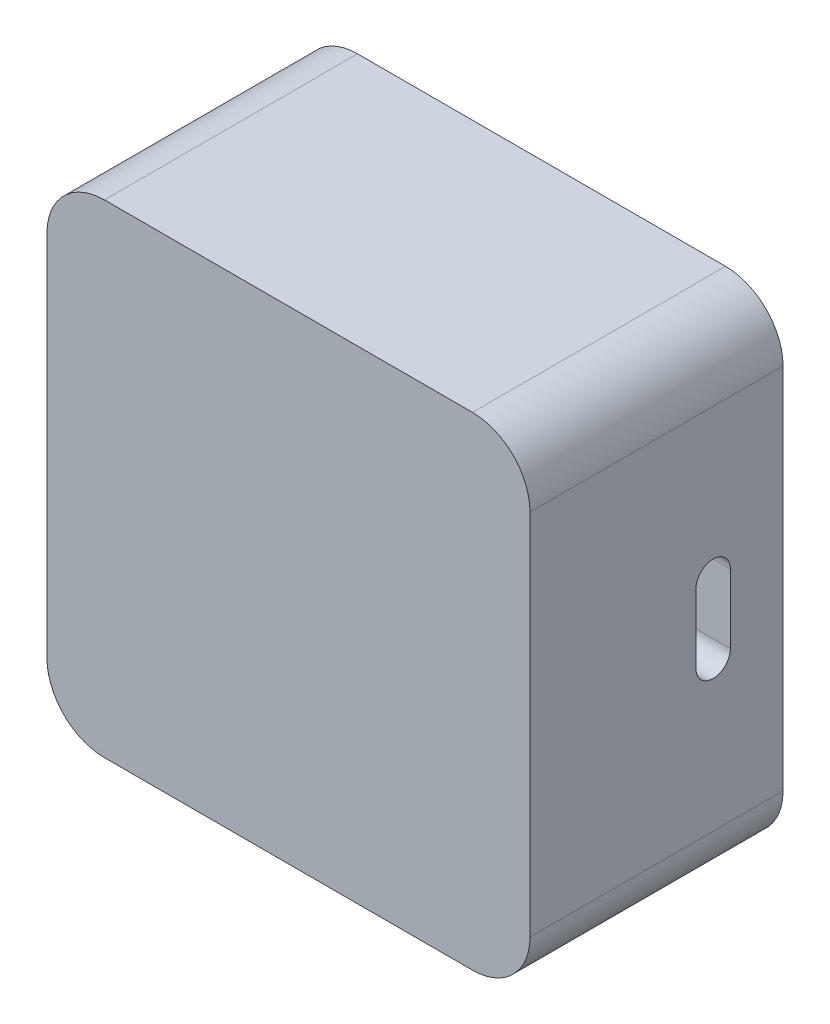
from build123d import *

# Parameters (mm, degrees)
SKETCH_1_W          = 42
SKETCH_1_H          = 42
EXTRUDE_1_DEPTH     = 22
SKETCH_2_R          = 1.5
CUT_EXTRUDE_1_DEPTH = 7
SKETCH_3_R          = 4
CUT_EXTRUDE_2_DEPTH = 10
FILLET_1_R          = 5


with BuildPart() as part:
    # 草图1 → 凸台-拉伸1 (new body)
    with BuildSketch(Plane.XY):
        Rectangle(SKETCH_1_W, SKETCH_1_H)
    extrude(amount=EXTRUDE_1_DEPTH)

    # 草图2 → 切除-拉伸1 (cut)
    with BuildSketch(Plane(origin=(21, 0, 0), x_dir=(0, 0, -1), z_dir=(1, 0, 0))):
        with Locations((-6.07507845, 3)):
            Circle(SKETCH_2_R)
        with BuildLine():
            ThreePointArc((-4.57507845, 3), (-6.07507845, 1.5), (-7.57507845, 3))
            Line((-7.57507845, 3), (-7.57507845, -3))
            ThreePointArc((-7.57507845, -3), (-6.07507845, -1.5), (-4.57507845, -3))
            Line((-4.57507845, -3), (-4.57507845, 3))
        make_face()
        with Locations((-6.07507845, -3)):
            Circle(SKETCH_2_R)
    extrude(amount=-CUT_EXTRUDE_1_DEPTH, mode=Mode.SUBTRACT)

    # 草图3 → 切除-拉伸2 (cut)
    with BuildSketch(Plane.XZ.offset(21)):
        with Locations(Location((0, 11, 0), (0, 0, 270))):
            Circle(SKETCH_3_R)
    extrude(amount=-CUT_EXTRUDE_2_DEPTH, mode=Mode.SUBTRACT)

    # 圆角1
    fillet_1_edges = [part.edges().sort_by_distance(p)[0] for p in [
        (-21, 21, 11),
        (21, 21, 11),
        (21, -21, 11),
        (-21, -21, 11),
    ]]
    fillet(fillet_1_edges, radius=FILLET_1_R)


solid = part.part
